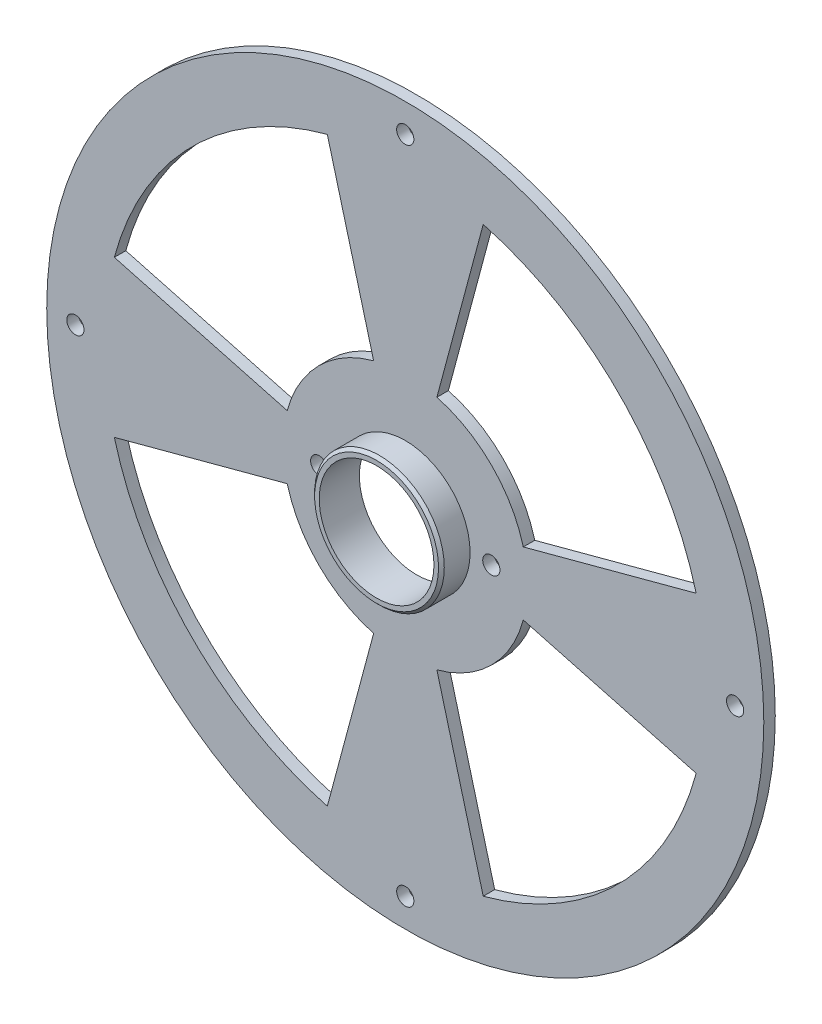
from build123d import *

# Parameters (mm, degrees)
SKETCH1_R           = 62.5
SKETCH1_R_2         = 1.5
BOSS_EXTRUDE1_DEPTH = 2
SKETCH2_R           = 11.3
BOSS_EXTRUDE2_DEPTH = 5
SECTORS_DEPTH       = 89.529656048
SKETCH_1_R          = 10
CUT_EXTRUDE_1_DEPTH = 89.665100237
CHAMFER_1_SIZE      = 0.5


with BuildPart() as part:
    # Sketch1 → Boss-Extrude1 (new body)
    with BuildSketch(Plane.XY):
        Circle(SKETCH1_R)
        with Locations((-57.5, 0)):
            Circle(SKETCH1_R_2, mode=Mode.SUBTRACT)
        with Locations((0, 57.5)):
            Circle(SKETCH1_R_2, mode=Mode.SUBTRACT)
        with Locations((57.5, 0)):
            Circle(SKETCH1_R_2, mode=Mode.SUBTRACT)
        with Locations((0, -57.5)):
            Circle(SKETCH1_R_2, mode=Mode.SUBTRACT)
        with Locations((-15, 0)):
            Circle(SKETCH1_R_2, mode=Mode.SUBTRACT)
        with Locations(Location((15, 0, 0), (0, 0, 180))):
            Circle(SKETCH1_R_2, mode=Mode.SUBTRACT)
    extrude(amount=BOSS_EXTRUDE1_DEPTH)

    # Sketch2 → Boss-Extrude2 (add)
    with BuildSketch(Plane.XY.offset(2)):
        Circle(SKETCH2_R)
    extrude(amount=BOSS_EXTRUDE2_DEPTH)

    # Sector (Cut Extrude) → Sectors (cut, through all)
    with BuildSketch(Plane.XY.offset(2)):
        with BuildLine():
            Line((20.5742201, -5.512845661), (50.71110588, -13.587999868))
            ThreePointArc((50.71110588, -13.587999868), (37.123106012, -37.123106012), (13.587999868, -50.71110588))
            Line((13.587999868, -50.71110588), (5.512845661, -20.5742201))
            ThreePointArc((5.512845661, -20.5742201), (15.061374439, -15.061374439), (20.5742201, -5.512845661))
        make_face()
        with BuildLine():
            Line((-20.5742201, -5.512845661), (-50.71110588, -13.587999868))
            ThreePointArc((-50.71110588, -13.587999868), (-37.123106012, -37.123106012), (-13.587999868, -50.71110588))
            Line((-13.587999868, -50.71110588), (-5.512845661, -20.5742201))
            ThreePointArc((-5.512845661, -20.5742201), (-15.061374439, -15.061374439), (-20.5742201, -5.512845661))
        make_face()
        with BuildLine():
            Line((-5.512845661, 20.5742201), (-13.587999868, 50.71110588))
            ThreePointArc((-13.587999868, 50.71110588), (-37.123106012, 37.123106012), (-50.71110588, 13.587999868))
            Line((-50.71110588, 13.587999868), (-20.5742201, 5.512845661))
            ThreePointArc((-20.5742201, 5.512845661), (-15.061374439, 15.061374439), (-5.512845661, 20.5742201))
        make_face()
        with BuildLine():
            Line((20.5742201, 5.512845661), (50.71110588, 13.587999868))
            ThreePointArc((50.71110588, 13.587999868), (37.123106012, 37.123106012), (13.587999868, 50.71110588))
            Line((13.587999868, 50.71110588), (5.512845661, 20.5742201))
            ThreePointArc((5.512845661, 20.5742201), (15.061374439, 15.061374439), (20.5742201, 5.512845661))
        make_face()
    extrude(amount=-SECTORS_DEPTH, mode=Mode.SUBTRACT)

    # Эскиз1 → Вырез-Вытянуть1 (cut, through all)
    with BuildSketch(Plane.XY.offset(7)):
        Circle(SKETCH_1_R)
    extrude(amount=-CUT_EXTRUDE_1_DEPTH, mode=Mode.SUBTRACT)

    # Фаска1
    chamfer_1_edges = [part.edges().sort_by_distance(p)[0] for p in [
        (-11.3, 0, 7),
    ]]
    chamfer(chamfer_1_edges, length=CHAMFER_1_SIZE)


solid = part.part
